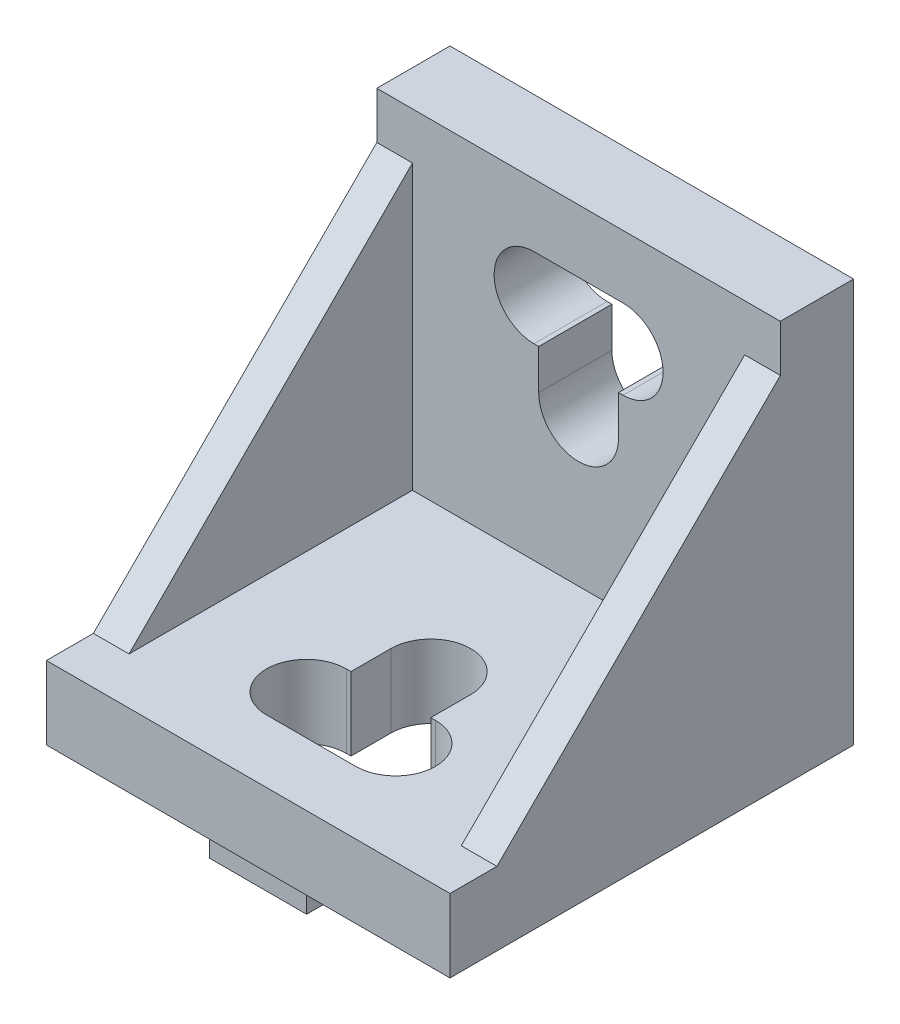
from build123d import *

# Parameters (mm, degrees)
SKETCH_1_W          = 43
SKETCH_1_H          = 43
EXTRUDE_1_DEPTH     = 7.8
SKETCH_3_W          = 43
SKETCH_3_H          = 43
EXTRUDE_2_DEPTH     = 7.8
EXTRUDE_3_DEPTH     = 3.8
CUT_EXTRUDE_1_DEPTH = 47.5138689
SKETCH_6_W          = 10.365035434
SKETCH_6_H          = 2.8
EXTRUDE_5_DEPTH     = 2.8


with BuildPart() as part:
    # 草图1 → 凸台-拉伸1 (new body)
    with BuildSketch(Plane.XY):
        Rectangle(SKETCH_1_W, SKETCH_1_H)
    extrude(amount=EXTRUDE_1_DEPTH)

    # 草图3 → 凸台-拉伸2 (add)
    with BuildSketch(Plane.XZ.offset(21.5)):
        with Locations((0, 21.5)):
            Rectangle(SKETCH_3_W, SKETCH_3_H)
    extrude(amount=-EXTRUDE_2_DEPTH)

    # 草图4 → 凸台-拉伸3 (add)
    with BuildSketch(Plane.ZY.offset(21.5)):
        Polygon((7.8, 16.5), (38, -13.7), (7.8, -13.7), align=None)
    extrude_3 = extrude(amount=-EXTRUDE_3_DEPTH)

    # 镜向1: 凸台-拉伸3 across plane
    add(extrude_3.mirror(Plane(origin=(0, 0, 0), x_dir=(0, 0, 1), z_dir=(1, 0, 0))))

    # 草图5 → 切除-拉伸1 (cut, through all)
    with BuildSketch(Plane.XY.offset(7.8)):
        with BuildLine():
            Line((-4.25, 2.05), (-4.25, 6.3))
            Line((-4.25, 6.3), (-4.75, 6.3))
            ThreePointArc((-4.75, 6.3), (-9, 10.55), (-4.75, 14.8))
            Line((-4.75, 14.8), (4.75, 14.8))
            ThreePointArc((4.75, 14.8), (9, 10.55), (4.75, 6.3))
            Line((4.75, 6.3), (4.25, 6.3))
            Line((4.25, 6.3), (4.25, 2.05))
            ThreePointArc((4.25, 2.05), (0, -2.2), (-4.25, 2.05))
        make_face()
    cut_extrude_1 = extrude(amount=-CUT_EXTRUDE_1_DEPTH, mode=Mode.SUBTRACT)

    # 镜向2: 切除-拉伸1 across plane
    add(cut_extrude_1.mirror(Plane(origin=(0, -10.75, 10.75), x_dir=(0, 0.7071067811865478, 0.7071067811865472), z_dir=(0, 0.7071067811865475, -0.7071067811865477))), mode=Mode.SUBTRACT)

    # 草图6 → 凸台-拉伸5 (add)
    with BuildSketch(Plane.XZ.offset(21.5)):
        with Locations((0, 40.55829283)):
            Rectangle(SKETCH_6_W, SKETCH_6_H)
    extrude(amount=EXTRUDE_5_DEPTH)


solid = part.part
